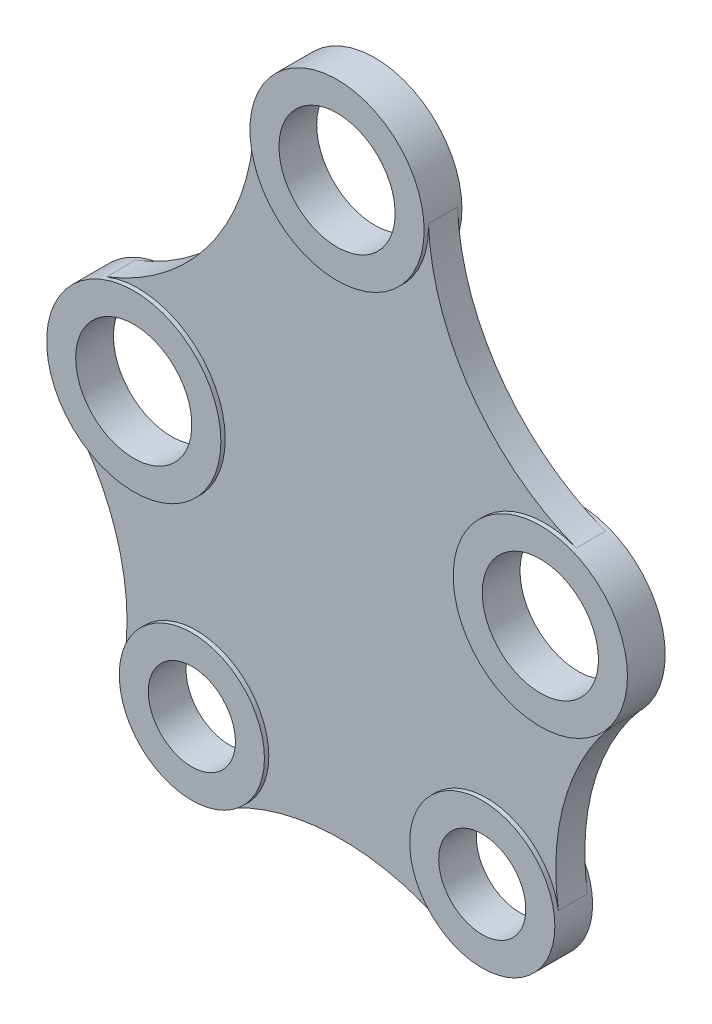
from build123d import *

# Parameters (mm, degrees)
SKETCH1_R             = 30
SKETCH1_R_2           = 20
BOSS_EXTRUDE1_DEPTH   = 6.5
BOSS_EXTRUDE1_2_DEPTH = 6.5
BOSS_EXTRUDE1_3_DEPTH = 6.5
SKETCH1_R_3           = 25
SKETCH1_R_4           = 15
BOSS_EXTRUDE1_4_DEPTH = 6.5
BOSS_EXTRUDE1_5_DEPTH = 6.5
BOSS_EXTRUDE2_DEPTH   = 5


with BuildPart() as part:
    # Sketch1 → Boss-Extrude1 (new, symmetric)
    with BuildSketch(Plane.XY):
        Circle(SKETCH1_R)
        Circle(SKETCH1_R_2, mode=Mode.SUBTRACT)
    extrude(amount=BOSS_EXTRUDE1_DEPTH, both=True)



with BuildPart() as body_2:
    # Sketch1 → Boss-Extrude1 2 (new, symmetric)
    with BuildSketch(Plane.XY):
        with Locations((70, -98)):
            Circle(SKETCH1_R)
        with Locations((70, -98)):
            Circle(SKETCH1_R_2, mode=Mode.SUBTRACT)
    extrude(amount=BOSS_EXTRUDE1_2_DEPTH, both=True)


with BuildPart() as body_3:
    # Sketch1 → Boss-Extrude1 3 (new, symmetric)
    with BuildSketch(Plane.XY):
        with Locations((-70, -98)):
            Circle(SKETCH1_R)
        with Locations((-70, -98)):
            Circle(SKETCH1_R_2, mode=Mode.SUBTRACT)
    extrude(amount=BOSS_EXTRUDE1_3_DEPTH, both=True)


with BuildPart() as body_4:
    # Sketch1 → Boss-Extrude1 4 (new, symmetric)
    with BuildSketch(Plane.XY):
        with Locations((50, -185)):
            Circle(SKETCH1_R_3)
        with Locations((50, -185)):
            Circle(SKETCH1_R_4, mode=Mode.SUBTRACT)
    extrude(amount=BOSS_EXTRUDE1_4_DEPTH, both=True)


with BuildPart() as body_5:
    # Sketch1 → Boss-Extrude1 5 (new, symmetric)
    with BuildSketch(Plane.XY):
        with Locations((-50, -185)):
            Circle(SKETCH1_R_3)
        with Locations((-50, -185)):
            Circle(SKETCH1_R_4, mode=Mode.SUBTRACT)
    extrude(amount=BOSS_EXTRUDE1_5_DEPTH, both=True)


with BuildPart() as part_1:
    add(part.part)

    add(body_2.part)  # Boss-Extrude2 merges body 2

    add(body_3.part)  # Boss-Extrude2 merges body 3

    add(body_4.part)  # Boss-Extrude2 merges body 4

    add(body_5.part)  # Boss-Extrude2 merges body 5
    # Sketch1<3> → Boss-Extrude2 (add, symmetric)
    with BuildSketch(Plane.XY):
        with BuildLine():
            ThreePointArc((29.974824802, 1.228770963), (29.99370554, 0.614514416), (30, 0))
            ThreePointArc((30, 0), (-0.614514416, -29.99370554), (-29.974824802, 1.228770963))
            ThreePointArc((-29.974824802, 1.228770963), (-44.809013245, -41.993561968), (-80.883915711, -70.04395631))
            ThreePointArc((-80.883915711, -70.04395631), (-53.066563718, -73.235938627), (-40, -98))
            ThreePointArc((-40, -98), (-59.649329868, -126.157834217), (-92.857575187, -117.430163575))
            ThreePointArc((-92.857575187, -117.430163575), (-76.859583983, -147.370140698), (-74.716930719, -181.248555502))
            ThreePointArc((-74.716930719, -181.248555502), (-48.118945506, -160.070867765), (-25, -185))
            ThreePointArc((-25, -185), (-28.521882675, -197.794157893), (-38.095238095, -206.983553944))
            ThreePointArc((-38.095238095, -206.983553944), (0, -197.330926563), (38.095238095, -206.983553944))
            ThreePointArc((38.095238095, -206.983553944), (35.626049477, -164.54542725), (74.716930719, -181.248555502))
            ThreePointArc((74.716930719, -181.248555502), (76.859583983, -147.370140698), (92.857575187, -117.430163575))
            ThreePointArc((92.857575187, -117.430163575), (40.914175072, -105.349475372), (80.883915711, -70.04395631))
            ThreePointArc((80.883915711, -70.04395631), (44.809013245, -41.993561968), (29.974824802, 1.228770963))
        make_face()
    extrude(amount=BOSS_EXTRUDE2_DEPTH, both=True)


solid = part_1.part
